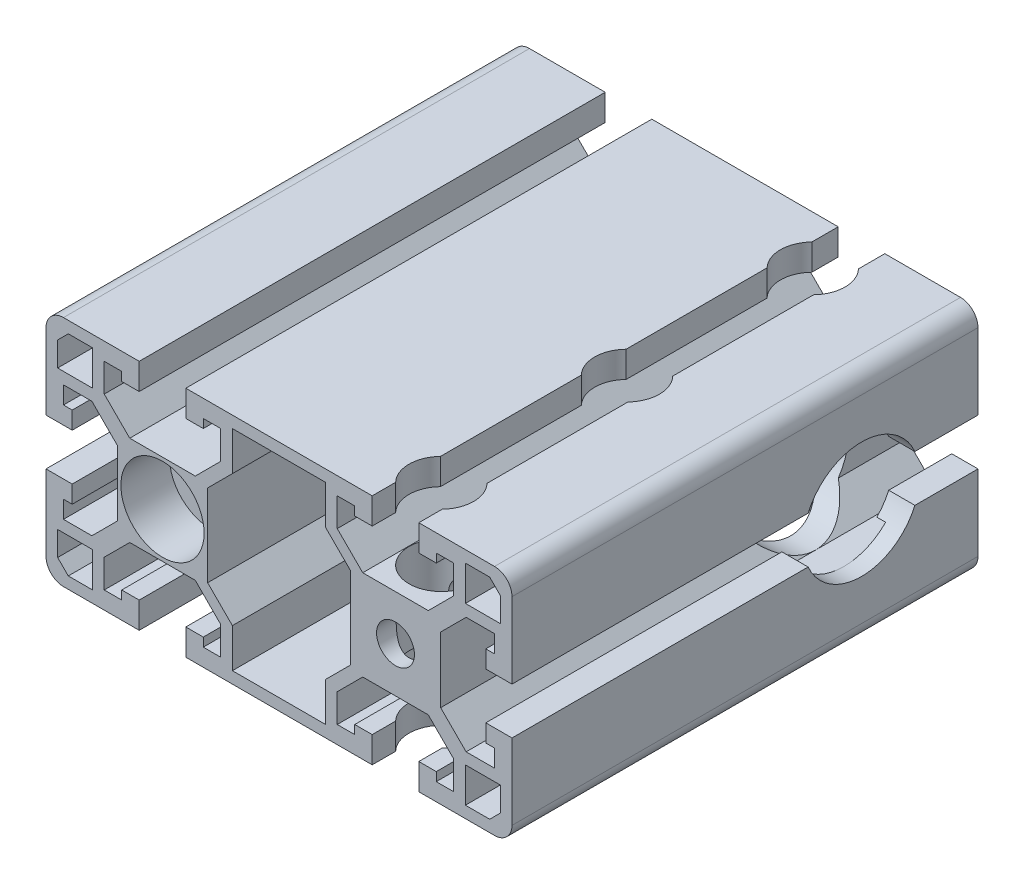
from build123d import *

# Parameters (mm, degrees)
SKETCH1_R                                            = 3.25
EXTRUSION1_DEPTH                                     = 40
F_20_0_20_DIAMETER_HOLE1_D                           = 20
F_20_0_20_DIAMETER_HOLE1_DEPTH                       = 16
CBORE_FOR_1_4_BINDING_HEAD_MACHINE_SCREW_D           = 8.3312
CBORE_FOR_1_4_BINDING_HEAD_MACHINE_SCREW_CBORE_D     = 14.2875
CBORE_FOR_1_4_BINDING_HEAD_MACHINE_SCREW_CBORE_DEPTH = 8.3312
F_11_0_11_DIAMETER_HOLE1_D                           = 11.1


with BuildPart() as part:
    # Sketch1 → Extrusion1 (new, symmetric)
    with BuildSketch(Plane.XY):
        with BuildLine():
            Line((-24, 24), (-24, 37))
            ThreePointArc((-24, 37), (-23.121320344, 39.121320344), (-21, 40))
            Line((-21, 40), (-8, 40))
            Line((-8, 40), (-8, 35.5))
            Line((-8, 35.5), (-11, 35.5))
            Line((-11, 35.5), (-11, 37))
            Line((-11, 37), (-14, 37))
            Line((-14, 37), (-14, 32.125))
            Line((-14, 32.125), (-9.625, 27.75))
            Line((-9.625, 27.75), (1.625, 27.75))
            Line((1.625, 27.75), (6, 32.125))
            Line((6, 32.125), (6, 37))
            Line((6, 37), (3, 37))
            Line((3, 37), (3, 35.5))
            Line((3, 35.5), (0, 35.5))
            Line((0, 35.5), (0, 40))
            Line((0, 40), (32, 40))
            Line((32, 40), (32, 35.5))
            Line((32, 35.5), (29, 35.5))
            Line((29, 35.5), (29, 37))
            Line((29, 37), (26, 37))
            Line((26, 37), (26, 32.125))
            Line((26, 32.125), (30.375, 27.75))
            Line((30.375, 27.75), (41.625, 27.75))
            Line((41.625, 27.75), (46, 32.125))
            Line((46, 32.125), (46, 37))
            Line((46, 37), (43, 37))
            Line((43, 37), (43, 35.5))
            Line((43, 35.5), (40, 35.5))
            Line((40, 35.5), (40, 40))
            Line((40, 40), (53, 40))
            ThreePointArc((53, 40), (55.121320344, 39.121320344), (56, 37))
            Line((56, 37), (56, 24))
            Line((56, 24), (51.5, 24))
            Line((51.5, 24), (51.5, 27))
            Line((51.5, 27), (53, 27))
            Line((53, 27), (53, 30))
            Line((53, 30), (48.125, 30))
            Line((48.125, 30), (43.75, 25.625))
            Line((43.75, 25.625), (43.75, 14.375))
            Line((43.75, 14.375), (48.125, 10))
            Line((48.125, 10), (53, 10))
            Line((53, 10), (53, 13))
            Line((53, 13), (51.5, 13))
            Line((51.5, 13), (51.5, 16))
            Line((51.5, 16), (56, 16))
            Line((56, 16), (56, 3))
            ThreePointArc((56, 3), (55.121320344, 0.878679656), (53, 0))
            Line((53, 0), (40, 0))
            Line((40, 0), (40, 4.5))
            Line((40, 4.5), (43, 4.5))
            Line((43, 4.5), (43, 3))
            Line((43, 3), (46, 3))
            Line((46, 3), (46, 7.875))
            Line((46, 7.875), (41.625, 12.25))
            Line((41.625, 12.25), (30.375, 12.25))
            Line((30.375, 12.25), (26, 7.875))
            Line((26, 7.875), (26, 3))
            Line((26, 3), (29, 3))
            Line((29, 3), (29, 4.5))
            Line((29, 4.5), (32, 4.5))
            Line((32, 4.5), (32, 0))
            Line((32, 0), (0, 0))
            Line((0, 0), (0, 4.5))
            Line((0, 4.5), (3, 4.5))
            Line((3, 4.5), (3, 3))
            Line((3, 3), (6, 3))
            Line((6, 3), (6, 7.875))
            Line((6, 7.875), (1.625, 12.25))
            Line((1.625, 12.25), (-9.625, 12.25))
            Line((-9.625, 12.25), (-14, 7.875))
            Line((-14, 7.875), (-14, 3))
            Line((-14, 3), (-11, 3))
            Line((-11, 3), (-11, 4.5))
            Line((-11, 4.5), (-8, 4.5))
            Line((-8, 4.5), (-8, 0))
            Line((-8, 0), (-21, 0))
            ThreePointArc((-21, 0), (-23.121320344, 0.878679656), (-24, 3))
            Line((-24, 3), (-24, 16))
            Line((-24, 16), (-19.5, 16))
            Line((-19.5, 16), (-19.5, 13))
            Line((-19.5, 13), (-21, 13))
            Line((-21, 13), (-21, 10))
            Line((-21, 10), (-16.125, 10))
            Line((-16.125, 10), (-11.75, 14.375))
            Line((-11.75, 14.375), (-11.75, 25.625))
            Line((-11.75, 25.625), (-16.125, 30))
            Line((-16.125, 30), (-21, 30))
            Line((-21, 30), (-21, 27))
            Line((-21, 27), (-19.5, 27))
            Line((-19.5, 27), (-19.5, 24))
            Line((-19.5, 24), (-24, 24))
        make_face()
        with Locations((36, 20)):
            Circle(SKETCH1_R, mode=Mode.SUBTRACT)
        with Locations((-4, 20)):
            Circle(SKETCH1_R, mode=Mode.SUBTRACT)
        Polygon((48, 2), (48, 8), (54, 8), (54, 3.828427125), (52.171572875, 2), align=None, mode=Mode.SUBTRACT)
        Polygon((54, 32), (48, 32), (48, 38), (52.171572875, 38), (54, 36.171572875), align=None, mode=Mode.SUBTRACT)
        Polygon((-16, 32), (-22, 32), (-22, 36.171572875), (-20.171572875, 38), (-16, 38), align=None, mode=Mode.SUBTRACT)
        Polygon((-22, 8), (-16, 8), (-16, 2), (-20.171572875, 2), (-22, 3.828427125), align=None, mode=Mode.SUBTRACT)
        Polygon((24, 31.296572875), (28.25, 27.046572875), (28.25, 12.953427125), (24, 8.703427125), (24, 2), (8, 2), (8, 8.703427125), (3.75, 12.953427125), (3.75, 27.046572875), (8, 31.296572875), (8, 38), (24, 38), align=None, mode=Mode.SUBTRACT)
    extrude(amount=EXTRUSION1_DEPTH, both=True)

    # Ø20.0 (20) Diameter Hole1
    with Locations(Plane(origin=(56, 0, 0), x_dir=(0, 0, -1), z_dir=(1, 0, 0))):
        with Locations((20, 20)):
            Hole(F_20_0_20_DIAMETER_HOLE1_D / 2, depth=F_20_0_20_DIAMETER_HOLE1_DEPTH)

    # CBORE for 1/4 Binding Head Machine Screw1 (through all)
    with Locations(Plane.XY.offset(40)):
        with Locations((-4, 20)):
            CounterBoreHole(CBORE_FOR_1_4_BINDING_HEAD_MACHINE_SCREW_D / 2, CBORE_FOR_1_4_BINDING_HEAD_MACHINE_SCREW_CBORE_D / 2, CBORE_FOR_1_4_BINDING_HEAD_MACHINE_SCREW_CBORE_DEPTH)

    # Ø11.0 (11) Diameter Hole1 (through all)
    with Locations(Plane(origin=(0, 40, 0), x_dir=(-1, 0, 0), z_dir=(0, 1, 0))):
        with Locations((-36, -31.63), (-36, 0.25), (-36, 32.13)):
            Hole(F_11_0_11_DIAMETER_HOLE1_D / 2)


solid = part.part
